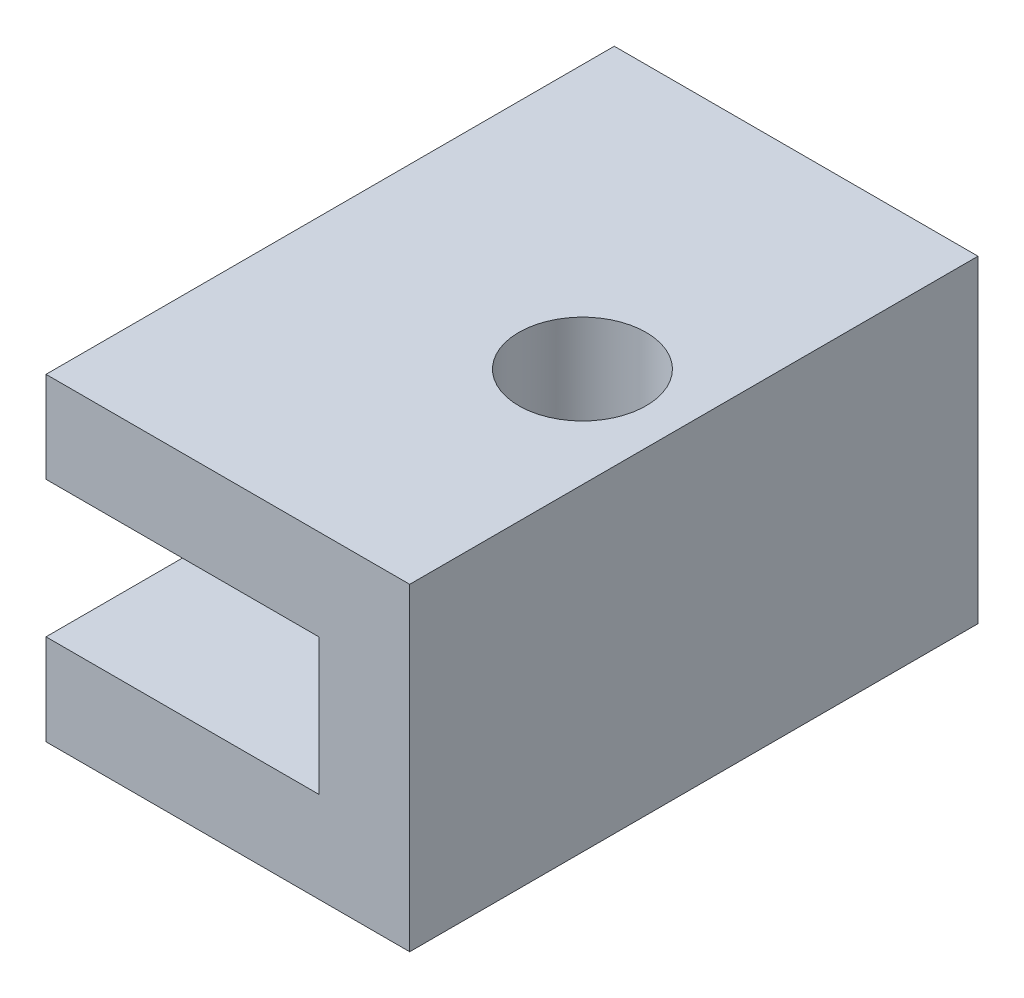
from build123d import *

# Parameters (mm, degrees)
BOSS_EXTRUDE1_DEPTH = 12.5
SKETCH2_R           = 1.4
CUT_EXTRUDE1_DEPTH  = 17.408839081


with BuildPart() as part:
    # Sketch1 → Boss-Extrude1 (new body)
    with BuildSketch(Plane.XY):
        Polygon((0, 0), (8, 0), (8, 7), (0, 7), (0, 5), (6, 5), (6, 2), (0, 2), align=None)
    extrude(amount=BOSS_EXTRUDE1_DEPTH)

    # Sketch2 → Cut-Extrude1 (cut, through all)
    with BuildSketch(Plane(origin=(0, 7, 0), x_dir=(1, 0, 0), z_dir=(0, 1, 0))):
        with Locations(Location((5.8, -6.5, 0), (0, 0, 180))):
            Circle(SKETCH2_R)
    extrude(amount=-CUT_EXTRUDE1_DEPTH, mode=Mode.SUBTRACT)


solid = part.part
